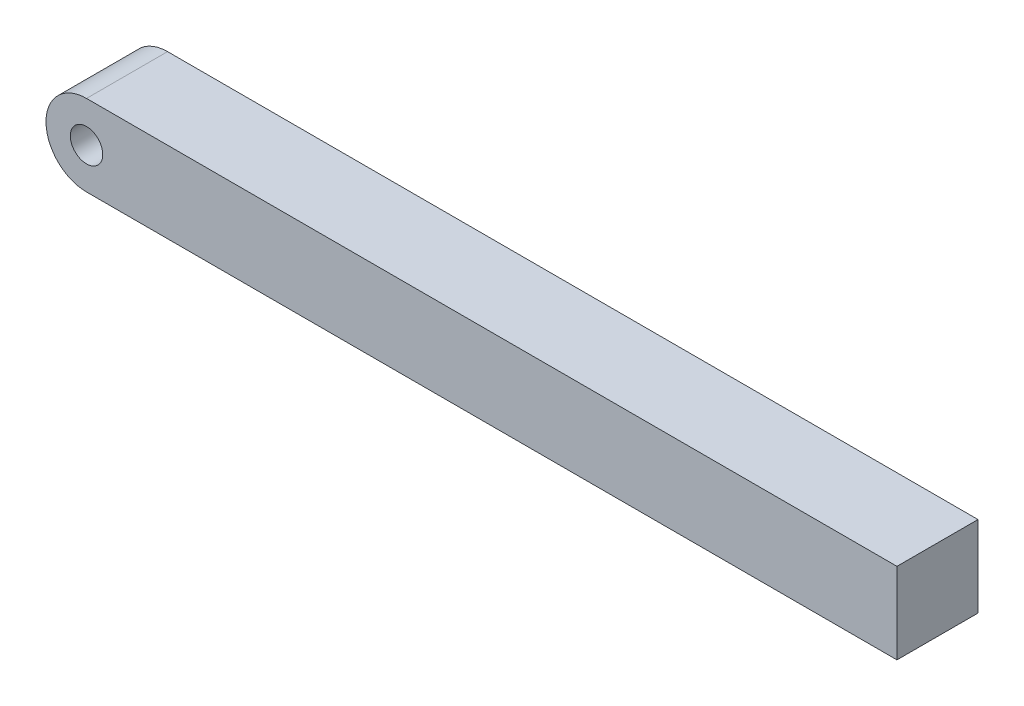
from build123d import *

# Parameters (mm, degrees)
EXTRUDE_1_DEPTH = 100


with BuildPart() as part:
    # ｽｹｯﾁ1 → ﾎﾞｽ - 押し出し1 (new body)
    with BuildSketch(Plane.XY):
        with BuildLine():
            ThreePointArc((-500, 50), (-550, 0), (-500, -50))
            Line((-500, -50), (-500, -20))
            ThreePointArc((-500, -20), (-520, 0), (-500, 20))
            Line((-500, 20), (-500, 50))
        make_face()
        with BuildLine():
            Line((-500, -20), (-500, -50))
            ThreePointArc((-500, -50), (-464.644660941, -35.355339059), (-450, 0))
            ThreePointArc((-450, 0), (-464.644660941, 35.355339059), (-500, 50))
            Line((-500, 50), (-500, 20))
            ThreePointArc((-500, 20), (-485.857864376, 14.142135624), (-480, 0))
            ThreePointArc((-480, 0), (-485.857864376, -14.142135624), (-500, -20))
        make_face()
        with BuildLine():
            ThreePointArc((-450, 0), (-464.644660941, -35.355339059), (-500, -50))
            Line((-500, -50), (500, -50))
            Line((500, -50), (500, 50))
            Line((500, 50), (-500, 50))
            ThreePointArc((-500, 50), (-464.644660941, 35.355339059), (-450, 0))
        make_face()
    extrude(amount=EXTRUDE_1_DEPTH)


solid = part.part
